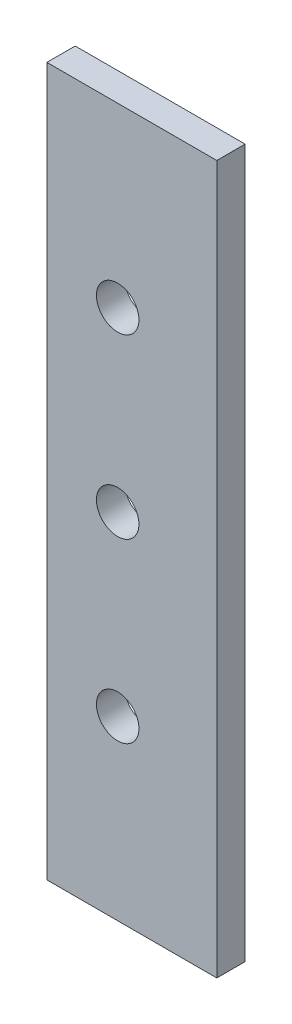
from build123d import *

# Parameters (mm, degrees)
SKETCH1_W            = 36
SKETCH1_H            = 150
BOSS_EXTRUDE1_DEPTH  = 6
M8_CLEARANCE_HOLE1_D = 9


with BuildPart() as part:
    # Sketch1 → Boss-Extrude1 (new body)
    with BuildSketch(Plane.XY):
        Rectangle(SKETCH1_W, SKETCH1_H)
    extrude(amount=BOSS_EXTRUDE1_DEPTH)

    # M8 Clearance Hole1 (through all)
    with Locations(Plane.XY.offset(6)):
        with Locations((-3, 37.5), (-3, 0), (-3, -37.5)):
            Hole(M8_CLEARANCE_HOLE1_D / 2)


solid = part.part
